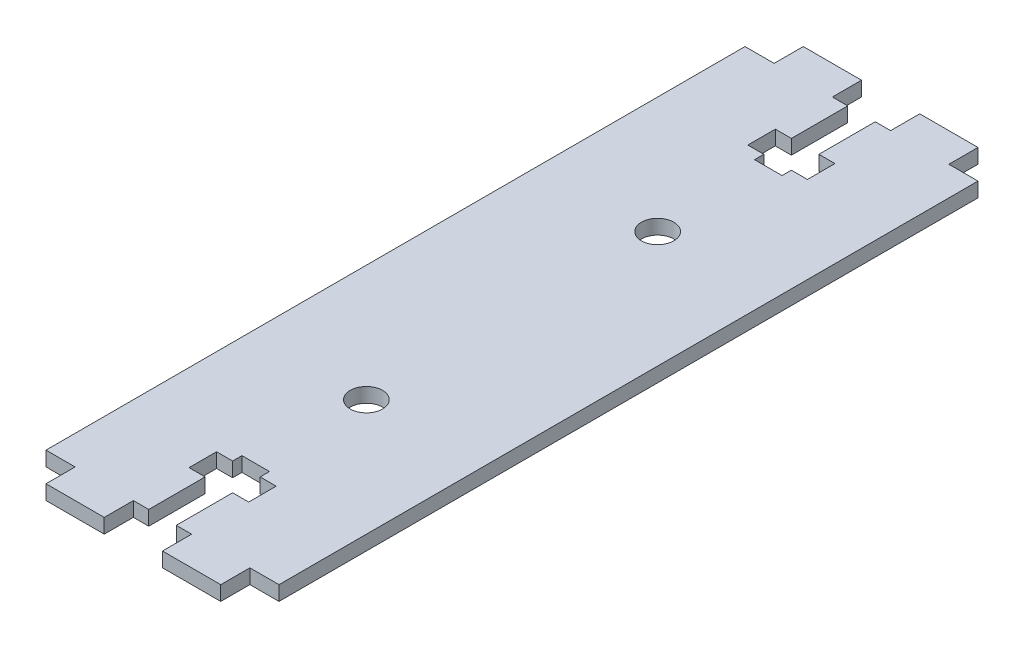
from build123d import *

# Parameters (mm, degrees)
SKETCH1_W           = 6.35
SKETCH1_H           = 3.175
BOSS_EXTRUDE1_DEPTH = 1.5875
SKETCH2_R           = 1.76403
CUT_EXTRUDE1_DEPTH  = 1.5875


with BuildPart() as part:
    # Sketch1 → Boss-Extrude1 (new body)
    with BuildSketch(Plane(origin=(0, 0, 0), x_dir=(1, 0, 0), z_dir=(0, 1, 0))):
        Polygon((0, 76.2), (0, 0), (3.175, 0), (9.525, 0), (11.2, 0), (11.2, 6.144), (9.45, 6.144), (9.45, 9.144), (11.2, 9.144), (11.2, 10.16), (14.2, 10.16), (14.2, 9.144), (15.95, 9.144), (15.95, 6.144), (14.2, 6.144), (14.2, 0), (15.875, 0), (22.225, 0), (25.4, 0), (25.4, 76.2), (22.225, 76.2), (15.875, 76.2), (14.2, 76.2), (14.2, 70.056), (15.95, 70.056), (15.95, 67.056), (14.2, 67.056), (14.2, 66.04), (11.2, 66.04), (11.2, 67.056), (9.45, 67.056), (9.45, 70.056), (11.2, 70.056), (11.2, 76.2), (9.525, 76.2), (3.175, 76.2), align=None)
        with Locations((6.35, 77.7875)):
            Rectangle(SKETCH1_W, SKETCH1_H)
        with Locations((19.05, 77.7875)):
            Rectangle(SKETCH1_W, SKETCH1_H)
        with Locations((6.35, -1.5875)):
            Rectangle(SKETCH1_W, SKETCH1_H)
        with Locations((19.05, -1.5875)):
            Rectangle(SKETCH1_W, SKETCH1_H)
    extrude(amount=BOSS_EXTRUDE1_DEPTH)

    # Sketch2 → Cut-Extrude1 (cut)
    with BuildSketch(Plane(origin=(0, 1.5875, 0), x_dir=(1, 0, 0), z_dir=(0, 1, 0))):
        with Locations(Location((12.7, 53.975, 0), (0, 0, 270))):
            Circle(SKETCH2_R)
        with Locations(Location((12.7, 22.225, 0), (0, 0, 270))):
            Circle(SKETCH2_R)
    extrude(amount=-CUT_EXTRUDE1_DEPTH, mode=Mode.SUBTRACT)


solid = part.part
